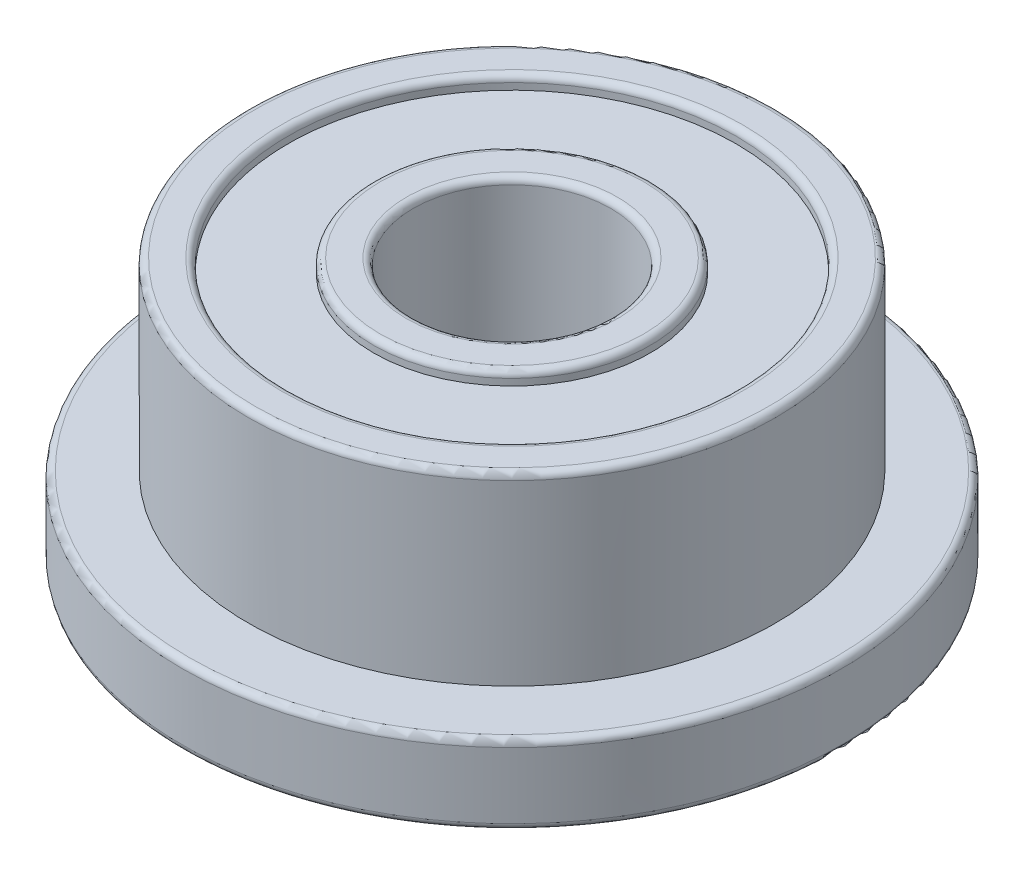
from build123d import *

# Parameters (mm, degrees)
SKETCH1_W = 0.3
SKETCH1_H = 2
SKETCH3_W = 0.65
SKETCH3_H = 1.8
FILLET1_R = 0.05
FILLET2_R = 0.05


with BuildPart() as part:
    # Sketch1 → Revolve1 (revolve)
    with BuildSketch(Plane.XY, mode=Mode.PRIVATE) as revolve1_sk:
        with Locations((0.9, 0)):
            Rectangle(SKETCH1_W, SKETCH1_H)
    revolve(revolve1_sk.sketch.rotate(Axis((0, -1.1, 0), (0, 1, 0)), 90), axis=Axis((0, -1.1, 0), (0, 1, 0)))

    # Fillet1
    fillet1_edges = [part.edges().sort_by_distance(p)[0] for p in [
        (0, 1, 0.75),
        (0, 1, 1.05),
        (0, -1, 1.05),
        (0, -1, 0.75),
    ]]
    fillet(fillet1_edges, radius=FILLET1_R)


with BuildPart() as body_2:
    # Sketch2 → Revolve2 (revolve)
    with BuildSketch(Plane.XY, mode=Mode.PRIVATE) as revolve2_sk:
        Polygon((1.7, 1), (1.7, -1), (2.5, -1), (2.5, -0.4), (2, -0.4), (2, 1), align=None)
    revolve(revolve2_sk.sketch.rotate(Axis((0, -1.1, 0), (0, 1, 0)), 90), axis=Axis((0, -1.1, 0), (0, 1, 0)))

    # Fillet2
    fillet2_edges = [body_2.edges().sort_by_distance(p)[0] for p in [
        (0, -1, 2.5),
        (0, -1, 1.7),
        (0, 1, 1.7),
        (0, 1, 2),
        (0, -0.4, 2.5),
    ]]
    fillet(fillet2_edges, radius=FILLET2_R)


with BuildPart() as body_3:
    # Sketch3 → Revolve3 (revolve)
    with BuildSketch(Plane.XY):
        with Locations((1.375, 0)):
            Rectangle(SKETCH3_W, SKETCH3_H)
    revolve(axis=Axis((0, -1.1, 0), (0, 1, 0)))


solid = Compound([part.part, body_2.part, body_3.part])
